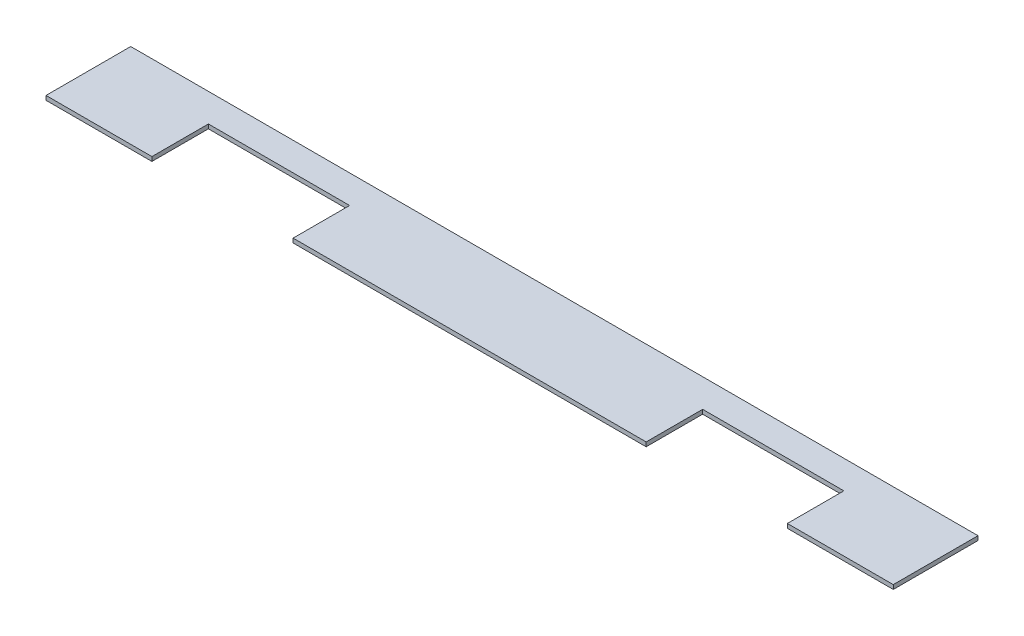
from build123d import *

# Parameters (mm, degrees)
SKETCH1_W           = 600
SKETCH1_H           = 60
BOSS_EXTRUDE1_DEPTH = 3
SKETCH2_W           = 100
SKETCH2_H           = 40
CUT_EXTRUDE1_DEPTH  = 10


with BuildPart() as part:
    # Sketch1 → Boss-Extrude1 (new body)
    with BuildSketch(Plane(origin=(0, 0, 0), x_dir=(1, 0, 0), z_dir=(0, 1, 0))):
        Rectangle(SKETCH1_W, SKETCH1_H)
    extrude(amount=BOSS_EXTRUDE1_DEPTH)

    # Sketch2 → Cut-Extrude1 (cut)
    with BuildSketch(Plane(origin=(0, 3, 0), x_dir=(1, 0, 0), z_dir=(0, 1, 0))):
        with Locations((-175, -10)):
            Rectangle(SKETCH2_W, SKETCH2_H)
        with Locations((175, -10)):
            Rectangle(SKETCH2_W, SKETCH2_H)
    extrude(amount=-CUT_EXTRUDE1_DEPTH, mode=Mode.SUBTRACT)


solid = part.part
